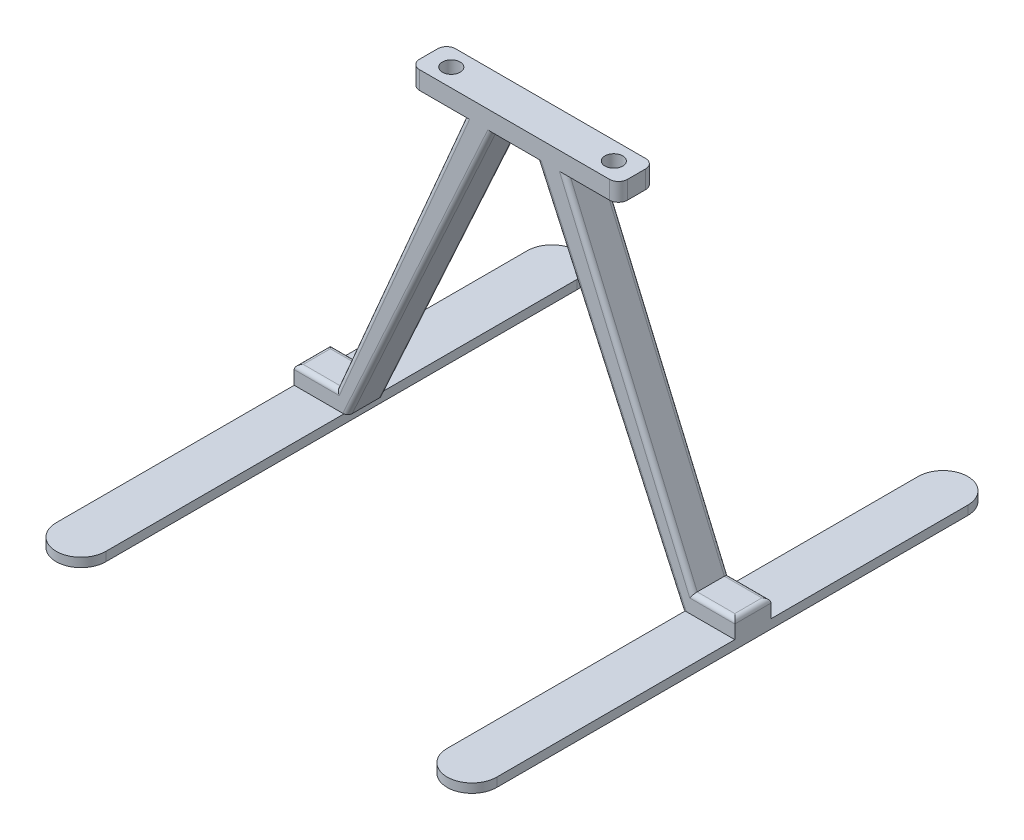
from build123d import *

# Parameters (mm, degrees)
SKETCH1_R           = 2.5
BOSS_EXTRUDE1_DEPTH = 5.08
BOSS_EXTRUDE2_DEPTH = 10.16
FILLET2_R           = 1.27
FILLET3_R           = 1.27
BOSS_EXTRUDE3_DEPTH = 2.54


with BuildPart() as part:
    # Sketch1 → Boss-Extrude1 (new body)
    with BuildSketch(Plane(origin=(0, 0, 0), x_dir=(1, 0, 0), z_dir=(0, 1, 0))):
        with BuildLine():
            Line((26.705849829, 5.08), (-26.705849829, 5.08))
            ThreePointArc((-26.705849829, 5.08), (-28.501901053, 4.336051224), (-29.245849829, 2.54))
            Line((-29.245849829, 2.54), (-29.245849829, -2.54))
            ThreePointArc((-29.245849829, -2.54), (-28.501901053, -4.336051224), (-26.705849829, -5.08))
            Line((-26.705849829, -5.08), (26.705849829, -5.08))
            ThreePointArc((26.705849829, -5.08), (28.501901053, -4.336051224), (29.245849829, -2.54))
            Line((29.245849829, -2.54), (29.245849829, 2.54))
            ThreePointArc((29.245849829, 2.54), (28.501901053, 4.336051224), (26.705849829, 5.08))
        make_face()
        with Locations(Location((-22.86, 0, 0), (0, 0, 270))):
            Circle(SKETCH1_R, mode=Mode.SUBTRACT)
        with Locations(Location((22.86, 0, 0), (0, 0, 90))):
            Circle(SKETCH1_R, mode=Mode.SUBTRACT)
    extrude(amount=BOSS_EXTRUDE1_DEPTH)

    # Sketch2 → Boss-Extrude2 (add)
    with BuildSketch(Plane.XY.offset(5.08)):
        Polygon((-14.007084232, 0), (-50.125026448, -84.328), (-61.947051412, -84.328), (-61.947051412, -89.408), (-50.8, -89.408), (-46.892843325, -89.408), (-6.12233164, 0), align=None)
        Polygon((50.8, -89.408), (61.947051412, -89.408), (61.947051412, -84.328), (50.125026448, -84.328), (14.007084232, 0), (6.12233164, 0), (46.892843325, -89.408), align=None)
    extrude(amount=-BOSS_EXTRUDE2_DEPTH)

    # Fillet2
    fillet2_edges = [part.edges().sort_by_distance(p)[0] for p in [
        (-56.03603893, -84.328, -5.08),
        (-61.947051412, -84.328, 0),
        (-56.03603893, -84.328, 5.08),
        (56.03603893, -84.328, -5.08),
        (61.947051412, -84.328, 0),
        (56.03603893, -84.328, 5.08),
    ]]
    fillet(fillet2_edges, radius=FILLET2_R)

    # Fillet3
    fillet3_edges = [part.edges().sort_by_distance(p)[0] for p in [
        (32.338027797, -42.799, 5.08),
        (26.507587483, -44.704, 5.08),
        (26.507587483, -44.704, -5.08),
        (32.338027797, -42.799, -5.08),
        (-26.507587483, -44.704, 5.08),
        (-26.507587483, -44.704, -5.08),
        (-32.338027797, -42.799, -5.08),
        (-32.338027797, -42.799, 5.08),
    ]]
    fillet(fillet3_edges, radius=FILLET3_R)

    # Sketch3 → Boss-Extrude3 (add)
    with BuildSketch(Plane.XZ.offset(89.408)):
        with BuildLine():
            Line((47.98747777, 72.005934115), (47.98747777, -60.440977769))
            ThreePointArc((47.98747777, -60.440977769), (54.967264591, -67.420764589), (61.947051412, -60.440977769))
            Line((61.947051412, -60.440977769), (61.947051412, 72.005934115))
            ThreePointArc((61.947051412, 72.005934115), (54.967264591, 78.985720936), (47.98747777, 72.005934115))
        make_face()
        with BuildLine():
            Line((-61.947051412, 72.005934115), (-61.947051412, -60.440977769))
            ThreePointArc((-61.947051412, -60.440977769), (-54.967264591, -67.420764589), (-47.98747777, -60.440977769))
            Line((-47.98747777, -60.440977769), (-47.98747777, 72.005934115))
            ThreePointArc((-47.98747777, 72.005934115), (-54.967264591, 78.985720936), (-61.947051412, 72.005934115))
        make_face()
    extrude(amount=BOSS_EXTRUDE3_DEPTH)


solid = part.part
